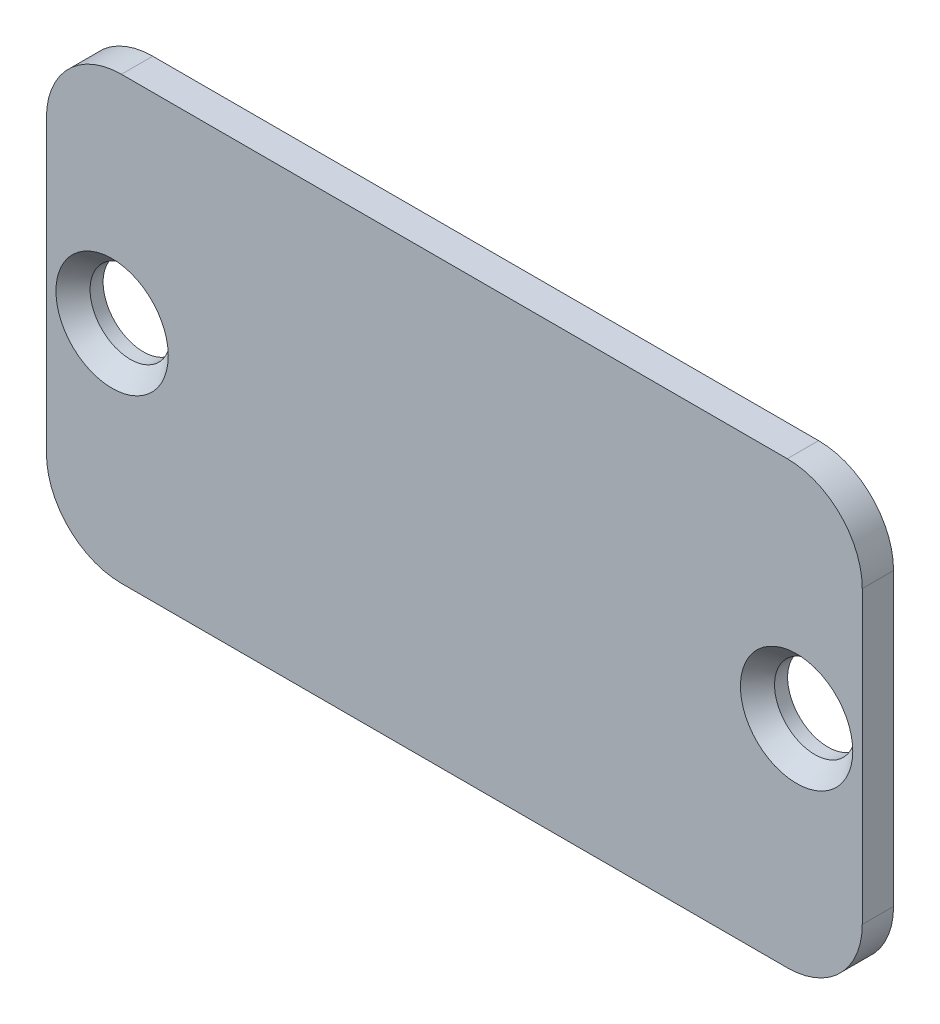
from build123d import *

# Parameters (mm, degrees)
BOSS_EXTRUDE1_DEPTH                            = 1.62814
CSK_FOR_M3_5_FLAT_HEAD_MACHINE_SCREW1_AT_COUNT = 2
CSK_FOR_M3_5_FLAT_HEAD_MACHINE_SCREW1_AT_PITCH = 35.6


with BuildPart() as part:
    # Sketch1 → Boss-Extrude1 (new body)
    with BuildSketch(Plane(origin=(0, 0, 31.399786773), x_dir=(-1, 0, 0), z_dir=(0, 0, -1))):
        with BuildLine():
            Line((16.918894582, 11.465), (-17.711105418, 11.465))
            ThreePointArc((-17.711105418, 11.465), (-20.468821865, 10.322716447), (-21.611105418, 7.565))
            Line((-21.611105418, 7.565), (-21.611105418, -7.565))
            ThreePointArc((-21.611105418, -7.565), (-20.468821865, -10.322716447), (-17.711105418, -11.465))
            Line((-17.711105418, -11.465), (16.918894582, -11.465))
            ThreePointArc((16.918894582, -11.465), (19.676611029, -10.322716447), (20.818894582, -7.565))
            Line((20.818894582, -7.565), (20.818894582, 7.565))
            ThreePointArc((20.818894582, 7.565), (19.676611029, 10.322716447), (16.918894582, 11.465))
        make_face()
    extrude(amount=-BOSS_EXTRUDE1_DEPTH)

    # Sketch2 → CSK for M3.5 Flat Head Machine Screw1 (revolve, cut)
    with BuildSketch(Plane(origin=(-17.403894582, 0, 33.027926773), x_dir=(0, -1, 0), z_dir=(1, 0, 0))):
        Polygon((0, 0), (0, 1.62814), (2.0955, 1.62814), (2.0955, 0.94962912), (2.921, 0), align=None)
    csk_for_m3_5_flat_head_machine_screw1 = revolve(axis=Axis((-17.403894582, 0, 39.377926773), (0, 0, -1)), mode=Mode.SUBTRACT)

    # CSK for M3.5 Flat Head Machine Screw1 at: CSK for M3.5 Flat Head Machine Screw1 ×2
    with Locations(*[(i * CSK_FOR_M3_5_FLAT_HEAD_MACHINE_SCREW1_AT_PITCH, 0, 0) for i in range(1, CSK_FOR_M3_5_FLAT_HEAD_MACHINE_SCREW1_AT_COUNT)]):
        add(csk_for_m3_5_flat_head_machine_screw1, mode=Mode.SUBTRACT)


solid = part.part
